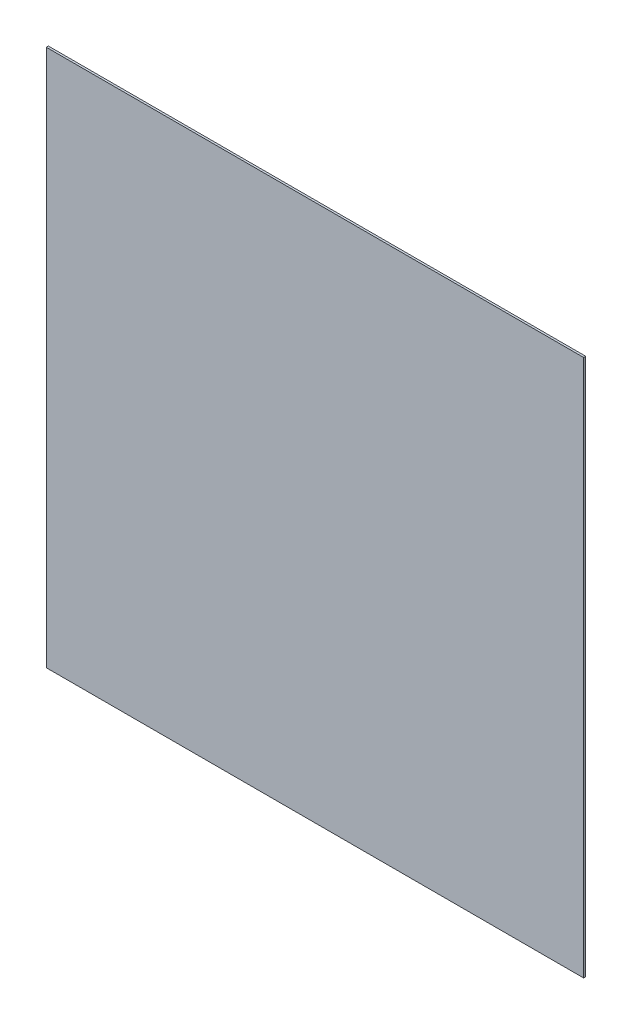
from build123d import *

# Parameters (mm, degrees)
SKETCH1_W           = 770
SKETCH1_H           = 770
BOSS_EXTRUDE1_DEPTH = 3


with BuildPart() as part:
    # Sketch1 → Boss-Extrude1 (new body)
    with BuildSketch(Plane.XY):
        with Locations((-28.368421053, -98.614035088)):
            Rectangle(SKETCH1_W, SKETCH1_H)
    extrude(amount=BOSS_EXTRUDE1_DEPTH)


solid = part.part
